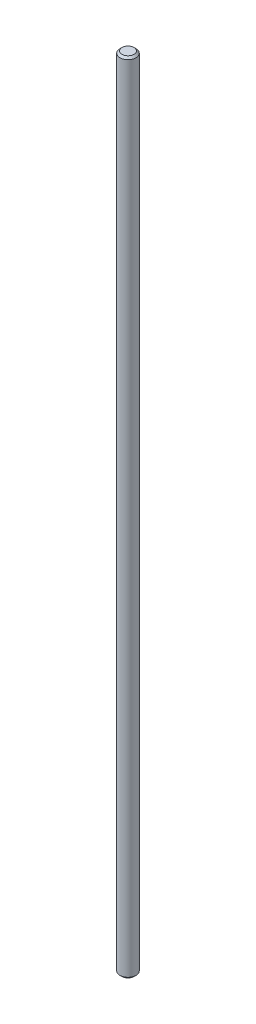
from build123d import *

# Parameters (mm, degrees)
SKETCH2_R           = 4
BOSS_EXTRUDE1_DEPTH = 200
CHAMFER1_SIZE       = 1


with BuildPart() as part:
    # Sketch2 → Boss-Extrude1 (new, symmetric)
    with BuildSketch(Plane(origin=(0, 0, 0), x_dir=(1, 0, 0), z_dir=(0, 1, 0))):
        with Locations(Location((0, 0, 0), (0, 0, 270))):
            Circle(SKETCH2_R)
    extrude(amount=BOSS_EXTRUDE1_DEPTH, both=True)

    # Chamfer1
    chamfer1_edges = [part.edges().sort_by_distance(p)[0] for p in [
        (0, -200, -4),
        (0, 200, -4),
    ]]
    chamfer(chamfer1_edges, length=CHAMFER1_SIZE)


solid = part.part
